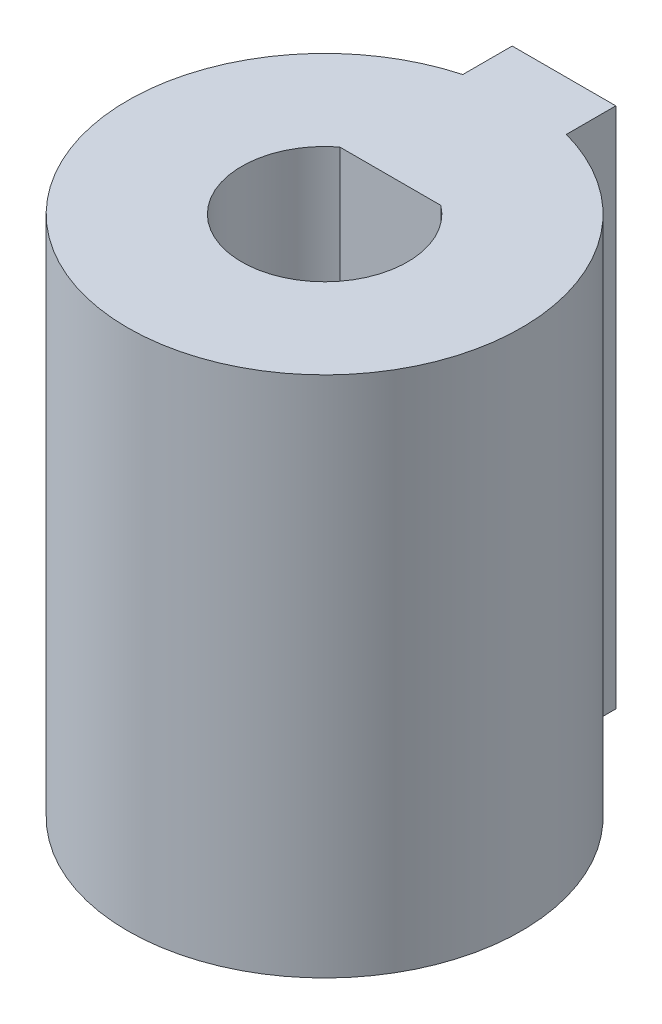
from build123d import *

# Parameters (mm, degrees)
SALIENTE_EXTRUIR1_DEPTH = 25.2


with BuildPart() as part:
    # Croquis1 → Saliente-Extruir1 (new body)
    with BuildSketch(Plane(origin=(0, 0, 0), x_dir=(1, 0, 0), z_dir=(0, 1, 0))):
        with BuildLine():
            Line((-2.5, 11.55), (2.5, 11.55))
            Line((2.5, 11.55), (2.5, 9.16515139))
            ThreePointArc((2.5, 9.16515139), (0, -9.5), (-2.5, 9.16515139))
            Line((-2.5, 9.16515139), (-2.5, 11.55))
        make_face()
        with BuildLine():
            Line((-2.439487651, 3.17), (2.439487651, 3.17))
            ThreePointArc((2.439487651, 3.17), (0, -4), (-2.439487651, 3.17))
        make_face(mode=Mode.SUBTRACT)
    extrude(amount=SALIENTE_EXTRUIR1_DEPTH)


solid = part.part
